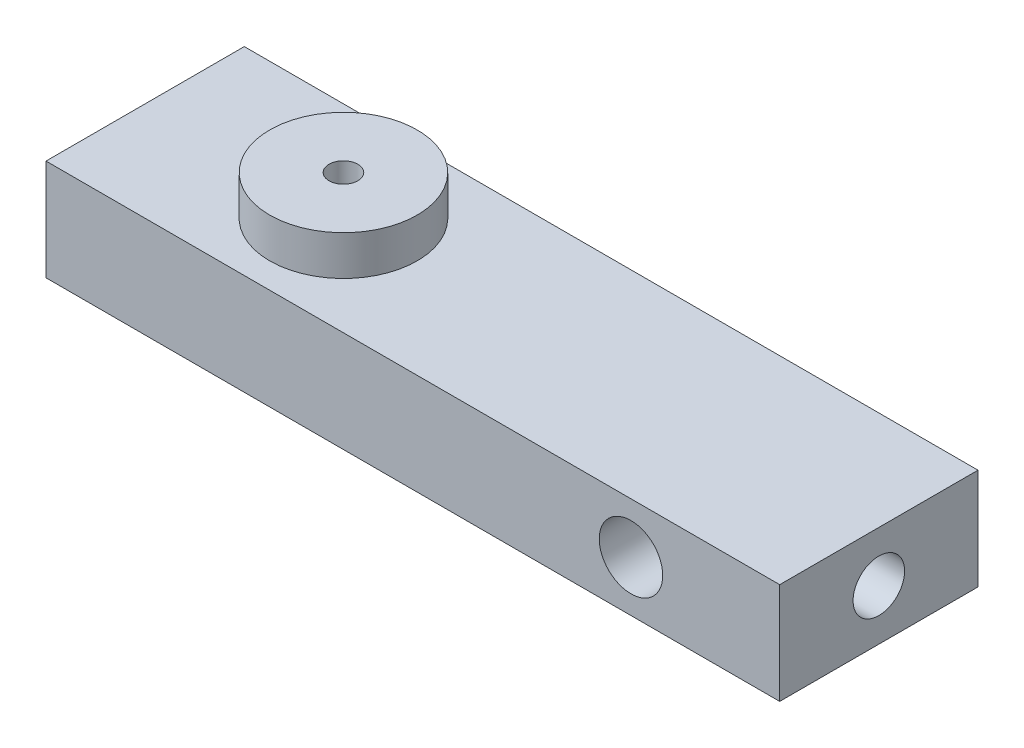
from build123d import *

# Parameters (mm, degrees)
SKETCH_1_W               = 15
SKETCH_1_H               = 10
EXTRUDE_1_DEPTH          = 5.1
SKETCH_2_R               = 1.6
CUT_EXTRUDE_1_DEPTH      = 14.500370365
SKETCH_3_R               = 1.3
CUT_EXTRUDE_2_DEPTH      = 3.8
CUT_EXTRUDE_3_REACH      = 15.283
CUT_EXTRUDE_3_END_RADIUS = 1.6
SKETCH_4_R               = 0.575
SKETCH_5_W               = 10
SKETCH_5_H               = 5.1
EXTRUDE_2_DEPTH          = 22
SKETCH_6_R               = 3.72
EXTRUDE_3_DEPTH          = 2
SKETCH_7_R               = 0.725
CUT_EXTRUDE_4_DEPTH      = 31.751585341


with BuildPart() as part:
    # 草图1 → 凸台-拉伸1 (new body)
    with BuildSketch(Plane(origin=(0, 0, 0), x_dir=(1, 0, 0), z_dir=(0, 1, 0))):
        Rectangle(SKETCH_1_W, SKETCH_1_H)
    extrude(amount=EXTRUDE_1_DEPTH)

    # 草图2 → 切除-拉伸1 (cut, through all)
    with BuildSketch(Plane.XY.offset(5)):
        with Locations((0, 2.55)):
            Circle(SKETCH_2_R)
    extrude(amount=-CUT_EXTRUDE_1_DEPTH, mode=Mode.SUBTRACT)

    # 草图3 → 切除-拉伸2 (cut)
    with BuildSketch(Plane(origin=(7.5, 0, 0), x_dir=(0, 0, -1), z_dir=(1, 0, 0))):
        with Locations((0, 2.55)):
            Circle(SKETCH_3_R)
    extrude(amount=-CUT_EXTRUDE_2_DEPTH, mode=Mode.SUBTRACT)

    # 切除-拉伸3: up to this cylinder (the profile starts outside it)
    cut_extrude_3_end = Plane(origin=(0, 2.55, 0), z_dir=(0, 0, 1)) * Cylinder(CUT_EXTRUDE_3_END_RADIUS, 34.766, mode=Mode.PRIVATE)
    # 草图4 → 切除-拉伸3 (cut, up to the surface)
    with BuildSketch(Plane(origin=(3.7, 0, 0), x_dir=(0, 0, -1), z_dir=(1, 0, 0)), mode=Mode.PRIVATE) as cut_extrude_3_sk1:
        with Locations((0, 2.55)):
            Circle(SKETCH_4_R)
    cut_extrude_3_tool1 = extrude(cut_extrude_3_sk1.sketch, amount=-CUT_EXTRUDE_3_REACH, mode=Mode.PRIVATE) - cut_extrude_3_end
    add(cut_extrude_3_tool1.solids().sort_by_distance((3.7, 2.55, 0))[0], mode=Mode.SUBTRACT)

    # 草图5 → 凸台-拉伸2 (add)
    with BuildSketch(Plane.ZY.offset(7.5)):
        with Locations((0, 2.55)):
            Rectangle(SKETCH_5_W, SKETCH_5_H)
    extrude(amount=EXTRUDE_2_DEPTH)

    # 草图6 → 凸台-拉伸3 (add)
    with BuildSketch(Plane(origin=(0, 5.1, 0), x_dir=(1, 0, 0), z_dir=(0, 1, 0))):
        with Locations(Location((-19.5, 0, 0), (0, 0, 270))):
            Circle(SKETCH_6_R)
    extrude(amount=EXTRUDE_3_DEPTH)

    # 草图7 → 切除-拉伸4 (cut, through all)
    with BuildSketch(Plane(origin=(0, 7.1, 0), x_dir=(1, 0, 0), z_dir=(0, 1, 0))):
        with Locations(Location((-19.5, 0, 0), (0, 0, 270))):
            Circle(SKETCH_7_R)
    extrude(amount=-CUT_EXTRUDE_4_DEPTH, mode=Mode.SUBTRACT)


solid = part.part
